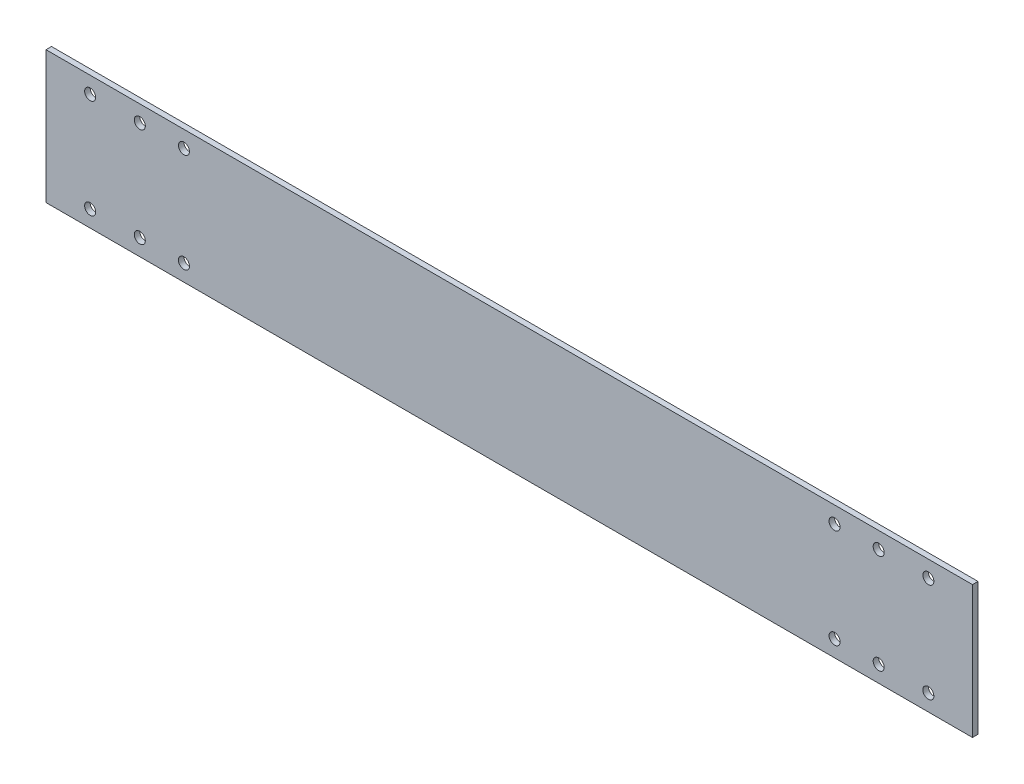
from build123d import *

# Parameters (mm, degrees)
SKETCH1_W                   = 533.146
SKETCH1_H                   = 76.2
BOSS_EXTRUDE1_DEPTH         = 3.175
F_1_4_0_25_DIAMETER_HOLE1_D = 6.35


with BuildPart() as part:
    # Sketch1 → Boss-Extrude1 (new body)
    with BuildSketch(Plane(origin=(0, -330.2, 0), x_dir=(1, 0, 0), z_dir=(0, 0, 1))):
        with Locations((19.368396109, 6574.00722403)):
            Rectangle(SKETCH1_W, SKETCH1_H)
    extrude(amount=BOSS_EXTRUDE1_DEPTH)

    # 1/4 (0.25) Diameter Hole1 (through all)
    with Locations(Plane(origin=(0, 0, 0), x_dir=(-1, 0, 0), z_dir=(0, 0, -1))):
        with Locations((-231.966396109, 6215.23222403), (-206.566396109, 6215.23222403), (-206.566396109, 6272.38222403), (-231.966396109, 6272.38222403), (-260.541396109, 6215.23222403), (-260.541396109, 6272.38222403), (221.804603891, 6272.38222403), (221.804603891, 6215.23222403), (193.229603891, 6272.38222403), (167.829603891, 6272.38222403), (167.829603891, 6215.23222403), (193.229603891, 6215.23222403)):
            Hole(F_1_4_0_25_DIAMETER_HOLE1_D / 2)


solid = part.part
